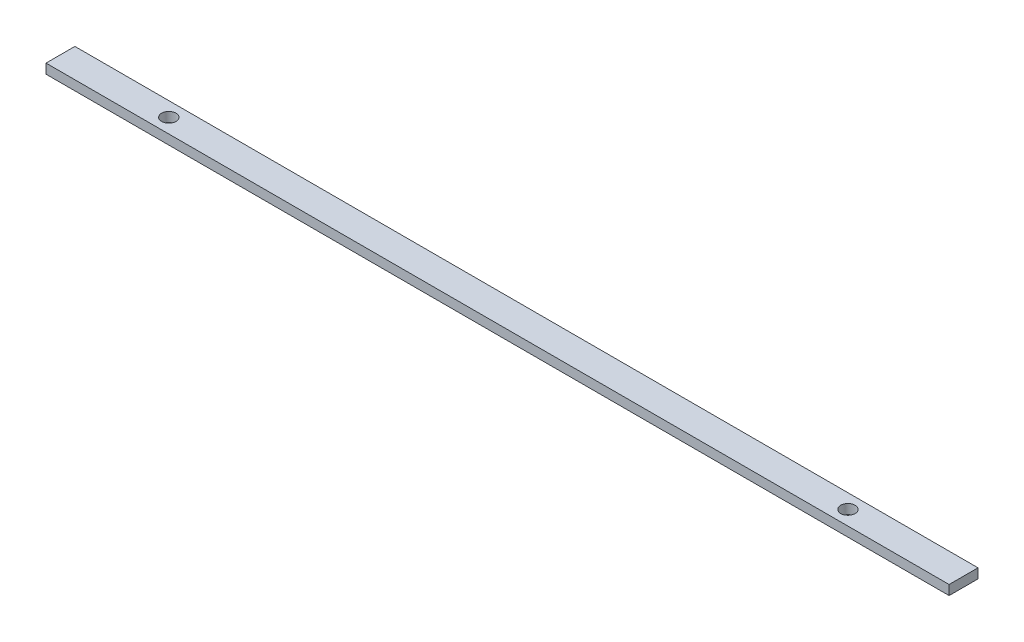
from build123d import *

# Parameters (mm, degrees)
SKETCH_1_W          = 375
SKETCH_1_H          = 12
EXTRUDE_1_DEPTH     = 4
SKETCH_2_R          = 3
CUT_EXTRUDE_1_DEPTH = 4


with BuildPart() as part:
    # Эскиз1 → Бобышка-Вытянуть1 (new body)
    with BuildSketch(Plane(origin=(0, 0, 0), x_dir=(1, 0, 0), z_dir=(0, 1, 0))):
        with Locations((187.5, 6)):
            Rectangle(SKETCH_1_W, SKETCH_1_H)
    extrude(amount=EXTRUDE_1_DEPTH)

    # Эскиз2 → Вырез-Вытянуть1 (cut)
    with BuildSketch(Plane(origin=(0, 4, 0), x_dir=(1, 0, 0), z_dir=(0, 1, 0))):
        with Locations(Location((45, 6, 0), (0, 0, 270))):
            Circle(SKETCH_2_R)
        with Locations(Location((327, 6, 0), (0, 0, 270))):
            Circle(SKETCH_2_R)
    extrude(amount=-CUT_EXTRUDE_1_DEPTH, mode=Mode.SUBTRACT)


solid = part.part
